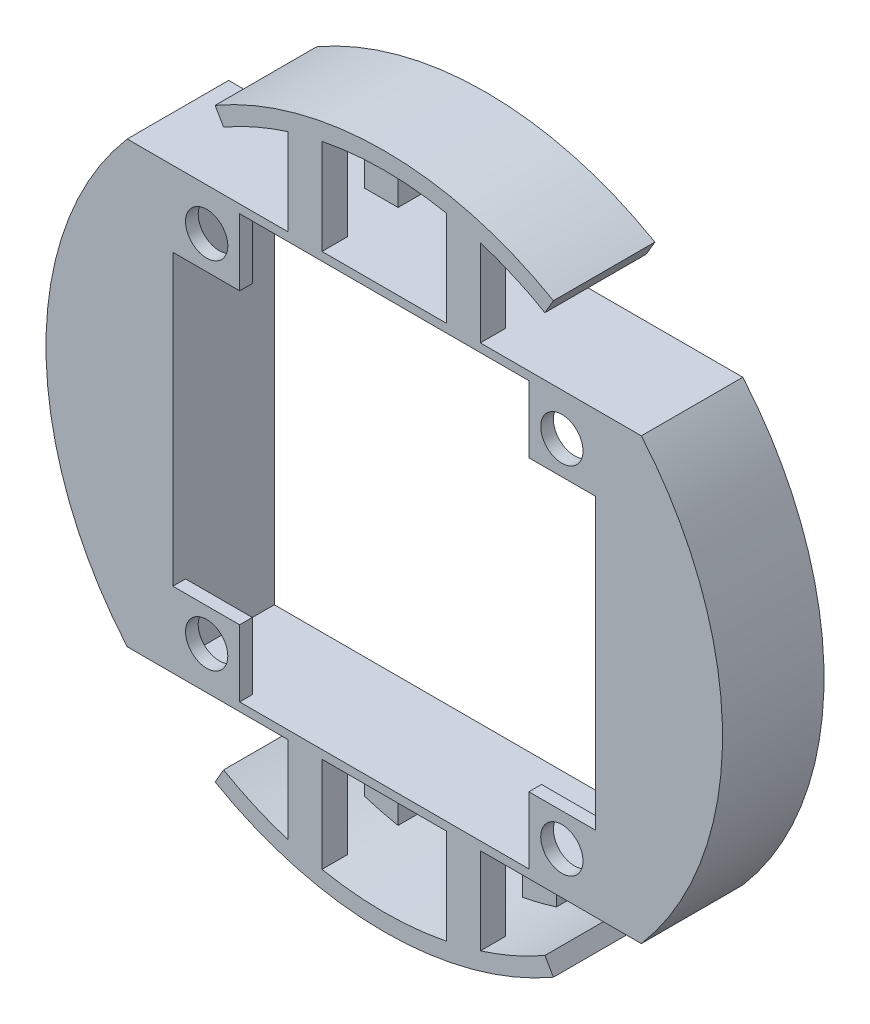
from build123d import *

# Parameters (mm, degrees)
BOSS_EXTRUDE1_DEPTH   = 12
BOSS_EXTRUDE1_2_DEPTH = 12
SKETCH1_W             = 50
SKETCH1_H             = 50
BOSS_EXTRUDE1_3_DEPTH = 12
SKETCH2_W             = 4
SKETCH2_H             = 12.279350853
BOSS_EXTRUDE2_DEPTH   = 3
SKETCH3_W             = 4
SKETCH3_H             = 12.244216487
SKETCH3_H_2           = 12.279350853
BOSS_EXTRUDE3_DEPTH   = 3
SKETCH4_W             = 13.297909738
SKETCH4_H             = 8.9
SKETCH4_R             = 2.5
BOSS_EXTRUDE4_DEPTH   = 1.5


with BuildPart() as part:
    # Sketch1 → Boss-Extrude1 (new body)
    with BuildSketch(Plane.XY):
        with BuildLine():
            Line((-19, 32.908965344), (-20, 34.641016151))
            ThreePointArc((-20, 34.641016151), (0, 40), (20, 34.641016151))
            Line((20, 34.641016151), (19, 32.908965344))
            ThreePointArc((19, 32.908965344), (0, 38), (-19, 32.908965344))
        make_face()
    extrude(amount=BOSS_EXTRUDE1_DEPTH)



with BuildPart() as body_2:
    # Sketch1 → Boss-Extrude1 2 (new body)
    with BuildSketch(Plane.XY):
        with BuildLine():
            Line((19, -32.908965344), (20, -34.641016151))
            ThreePointArc((20, -34.641016151), (0, -40), (-20, -34.641016151))
            Line((-20, -34.641016151), (-19, -32.908965344))
            ThreePointArc((-19, -32.908965344), (0, -38), (19, -32.908965344))
        make_face()
    extrude(amount=BOSS_EXTRUDE1_2_DEPTH)


with BuildPart() as body_3:
    # Sketch1 → Boss-Extrude1 3 (new body)
    with BuildSketch(Plane.XY):
        with BuildLine():
            Line((-30.397368307, 26), (-26, 26))
            Line((-26, 26), (23.958297101, 26))
            Line((23.958297101, 26), (30.397368307, 26))
            ThreePointArc((30.397368307, 26), (40, 0), (30.397368307, -26))
            Line((30.397368307, -26), (23.958297101, -26))
            Line((23.958297101, -26), (-26, -26))
            Line((-26, -26), (-30.397368307, -26))
            ThreePointArc((-30.397368307, -26), (-40, 0), (-30.397368307, 26))
        make_face()
        Rectangle(SKETCH1_W, SKETCH1_H, mode=Mode.SUBTRACT)
    extrude(amount=BOSS_EXTRUDE1_3_DEPTH)


with BuildPart() as part_1:
    add(part.part)

    add(body_2.part)  # Boss-Extrude2 merges body 2

    add(body_3.part)  # Boss-Extrude2 merges body 3
    # Sketch2 → Boss-Extrude2 (add)
    with BuildSketch(Plane.XY.offset(12)):
        with Locations((-9.365459931, 31.139675427)):
            Rectangle(SKETCH2_W, SKETCH2_H)
        with Locations((9.365459931, 31.139675427)):
            Rectangle(SKETCH2_W, SKETCH2_H)
        with Locations((9.365459931, -31.139675427)):
            Rectangle(SKETCH2_W, SKETCH2_H)
        with Locations((-9.365459931, -31.139675427)):
            Rectangle(SKETCH2_W, SKETCH2_H)
    extrude(amount=-BOSS_EXTRUDE2_DEPTH)

    # Sketch3 → Boss-Extrude3 (add)
    with BuildSketch(Plane(origin=(0, 0, 0), x_dir=(-1, 0, 0), z_dir=(0, 0, -1))):
        with Locations((-9.365459931, 31.122108244)):
            Rectangle(SKETCH3_W, SKETCH3_H)
        with Locations((9.365459931, 31.139675427)):
            Rectangle(SKETCH3_W, SKETCH3_H_2)
        with Locations((-9.365459931, -31.139675427)):
            Rectangle(SKETCH3_W, SKETCH3_H_2)
        with Locations((9.365459931, -31.139675427)):
            Rectangle(SKETCH3_W, SKETCH3_H_2)
    extrude(amount=-BOSS_EXTRUDE3_DEPTH)

    # Sketch4 → Boss-Extrude4 (add)
    # profile 1 of 4: a face of its own
    with BuildSketch(Plane.XY.offset(12)):
        with Locations((-23.748413438, -21.55)):
            Rectangle(SKETCH4_W, SKETCH4_H)
        with Locations((-21, -21)):
            Circle(SKETCH4_R, mode=Mode.SUBTRACT)
    # profile 2 of 4: a face of its own
    with BuildSketch(Plane.XY.offset(12)):
        with Locations((23.748413438, -21.55)):
            Rectangle(SKETCH4_W, SKETCH4_H)
        with Locations(Location((21, -21, 0), (0, 0, 180))):
            Circle(SKETCH4_R, mode=Mode.SUBTRACT)
    # profile 3 of 4: a face of its own
    with BuildSketch(Plane.XY.offset(12)):
        with Locations((23.748413438, 21.55)):
            Rectangle(SKETCH4_W, SKETCH4_H)
        with Locations((21, 21)):
            Circle(SKETCH4_R, mode=Mode.SUBTRACT)
    # profile 4 of 4: a face of its own
    with BuildSketch(Plane.XY.offset(12)):
        with Locations((-23.748413438, 21.55)):
            Rectangle(SKETCH4_W, SKETCH4_H)
        with Locations(Location((-21, 21, 0), (0, 0, 180))):
            Circle(SKETCH4_R, mode=Mode.SUBTRACT)
    extrude(amount=-BOSS_EXTRUDE4_DEPTH)


solid = part_1.part
